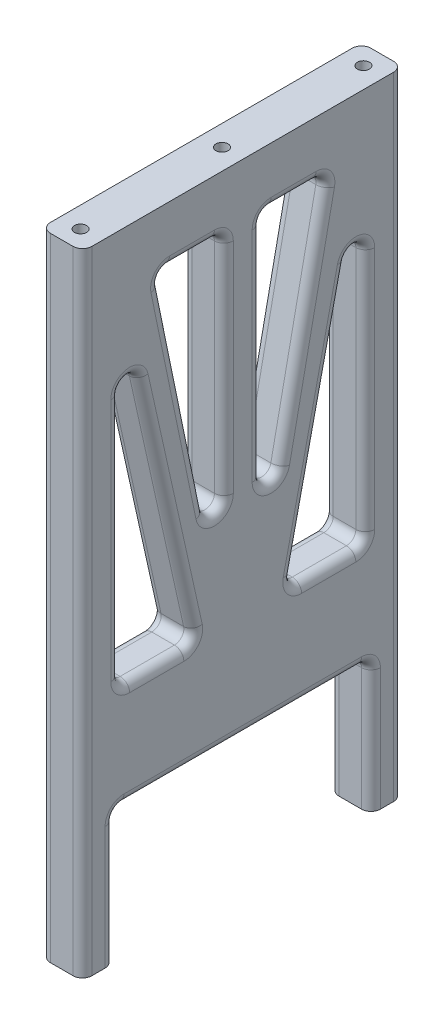
from build123d import *

# Parameters (mm, degrees)
SKETCH1_W           = 85
SKETCH1_H           = 125
SKETCH1_W_2         = 65
SKETCH1_H_2         = 90
BOSS_EXTRUDE1_DEPTH = 11
SKETCH2_W           = 5
SKETCH2_H           = 85
BOSS_EXTRUDE2_DEPTH = 11
SKETCH3_R           = 1.5
CUT_EXTRUDE1_DEPTH  = 10
SKETCH4_R           = 1.6
CUT_EXTRUDE2_DEPTH  = 10
FILLET1_R           = 2.5


with BuildPart() as part:
    # Sketch1 → Boss-Extrude1 (new body)
    # profile 1 of 6: a face of its own
    with BuildSketch(Plane(origin=(0, 0, 0), x_dir=(0, 0, -1), z_dir=(1, 0, 0))):
        with Locations((0, 87.5)):
            Rectangle(SKETCH1_W, SKETCH1_H)
        with Locations((0, 90)):
            Rectangle(SKETCH1_W_2, SKETCH1_H_2, mode=Mode.SUBTRACT)
    # profile 2 of 6: a face of its own
    with BuildSketch(Plane(origin=(0, 0, 0), x_dir=(0, 0, -1), z_dir=(1, 0, 0))):
        Polygon((-42.5, 25), (-42.5, -17.5), (-34, -17.5), (-34, 17.5), (34, 17.5), (34, -17.5), (42.5, -17.5), (42.5, 25), align=None)
    # profile 3 of 6: a face of its own
    with BuildSketch(Plane(origin=(0, 0, 0), x_dir=(0, 0, -1), z_dir=(1, 0, 0))):
        Polygon((-42.5, 25), (-42.5, -17.5), (-34, -17.5), (-34, 17.5), (34, 17.5), (34, -17.5), (42.5, -17.5), (42.5, 25), align=None)
    # profile 4 of 6: a face of its own
    with BuildSketch(Plane(origin=(0, 0, 0), x_dir=(0, 0, -1), z_dir=(1, 0, 0))):
        Polygon((-42.5, 25), (-42.5, -17.5), (-34, -17.5), (-34, 17.5), (34, 17.5), (34, -17.5), (42.5, -17.5), (42.5, 25), align=None)
    # profile 5 of 6: a face of its own
    with BuildSketch(Plane(origin=(0, 0, 0), x_dir=(0, 0, -1), z_dir=(1, 0, 0))):
        Polygon((-42.5, 25), (-42.5, -17.5), (-34, -17.5), (-34, 17.5), (34, 17.5), (34, -17.5), (42.5, -17.5), (42.5, 25), align=None)
    # profile 6 of 6: a face of its own
    with BuildSketch(Plane(origin=(0, 0, 0), x_dir=(0, 0, -1), z_dir=(1, 0, 0))):
        Polygon((-42.5, 25), (-42.5, -17.5), (-34, -17.5), (-34, 17.5), (34, 17.5), (34, -17.5), (42.5, -17.5), (42.5, 25), align=None)
    extrude(amount=BOSS_EXTRUDE1_DEPTH)

    # Sketch2 → Boss-Extrude2 (add, through all)
    with BuildSketch(Plane(origin=(11, 0, 0), x_dir=(0, 0, -1), z_dir=(1, 0, 0))):
        Polygon((-22.5, 135), (-32.5, 135), (-12.5, 45), (0, 45), (0, 50), (-5, 50), align=None)
        with Locations((-2.5, 92.5)):
            Rectangle(SKETCH2_W, SKETCH2_H)
        with Locations((2.5, 92.5)):
            Rectangle(SKETCH2_W, SKETCH2_H)
        Polygon((0, 50), (0, 45), (12.5, 45), (32.5, 135), (22.5, 135), (5, 50), align=None)
    extrude(amount=-BOSS_EXTRUDE2_DEPTH)

    # Sketch3 → Cut-Extrude1 (cut)
    with BuildSketch(Plane.XZ.offset(17.5)):
        with Locations(Location((5.5, 37.5, 0), (0, 0, 270))):
            Circle(SKETCH3_R)
        with Locations(Location((5.5, -37.5, 0), (0, 0, 90))):
            Circle(SKETCH3_R)
    extrude(amount=-CUT_EXTRUDE1_DEPTH, mode=Mode.SUBTRACT)

    # Sketch4 → Cut-Extrude2 (cut)
    with BuildSketch(Plane(origin=(0, 150, 0), x_dir=(1, 0, 0), z_dir=(0, 1, 0))):
        with Locations(Location((5.5, 37.5, 0), (0, 0, 270))):
            Circle(SKETCH4_R)
        with Locations(Location((5.5, -37.5, 0), (0, 0, 90))):
            Circle(SKETCH4_R)
        with Locations(Location((5.5, 0, 0), (0, 0, 270))):
            Circle(SKETCH4_R)
    extrude(amount=-CUT_EXTRUDE2_DEPTH, mode=Mode.SUBTRACT)

    # Fillet1
    fillet1_edges = [part.edges().sort_by_distance(p)[0] for p in [
        (0, 66.25, -42.5),
        (0, 0, -34),
        (0, 17.5, 0),
        (0, 0, 34),
        (0, 66.25, 42.5),
        (11, 0, 34),
        (5.5, 17.5, -34),
        (5.5, 17.5, 34),
        (11, 17.5, 0),
        (0, 45, 22.5),
        (11, 0, -34),
        (5.5, 45, 32.5),
        (11, 90, -32.5),
        (5.5, 45, -32.5),
        (5.5, 135, -32.5),
        (0, 90, 32.5),
        (5.5, 135, 32.5),
        (11, 45, 22.5),
        (11, 90, 32.5),
        (0, 90, -32.5),
        (11, 66.25, -42.5),
        (0, 135, 13.75),
        (0, 135, -13.75),
        (11, 135, 13.75),
        (11, 135, -13.75),
        (0, 45, -22.5),
        (11, 66.25, 42.5),
        (11, 45, -22.5),
        (11, 92.5, -13.75),
        (5.5, 50, -5),
        (5.5, 135, -22.5),
        (11, 90, -22.5),
        (5.5, 45, -12.5),
        (0, 90, 22.5),
        (5.5, 45, 12.5),
        (11, 92.5, 13.75),
        (5.5, 135, 22.5),
        (11, 92.5, 5),
        (5.5, 50, 5),
        (5.5, 135, 5),
        (0, 92.5, -5),
        (5.5, 135, -5),
        (0, 92.5, -13.75),
        (0, 90, -22.5),
        (0, 92.5, 13.75),
        (0, 92.5, 5),
        (11, 92.5, -5),
        (11, 90, 22.5),
    ]]
    fillet(fillet1_edges, radius=FILLET1_R)


solid = part.part
